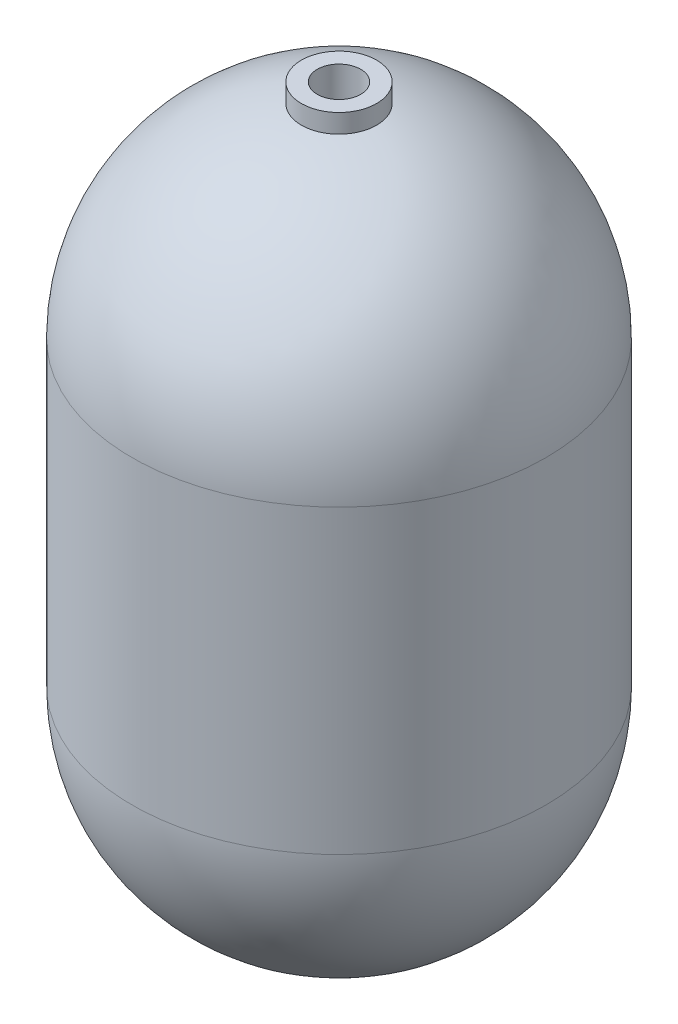
from build123d import *

# Parameters (mm, degrees)
F_5_8_18_TAPPED_HOLE2_D     = 14.68374
F_5_8_18_TAPPED_HOLE2_DEPTH = 38.862
F_5_8_18_TAPPED_HOLE2_TIP   = 4.411440553


with BuildPart() as part:
    # Sketch4 → Revolve1 (revolve)
    with BuildSketch(Plane.XY, mode=Mode.PRIVATE) as revolve1_sk:
        with BuildLine():
            Line((12.7, 75.035751798), (12.7, 68.685751798))
            ThreePointArc((12.7, 68.685751798), (53.694122118, 44.676210112), (69.85, 0))
            Line((69.85, 0), (69.85, -101.6))
            ThreePointArc((69.85, -101.6), (49.391408666, -150.991408666), (0, -171.45))
            Line((0, -171.45), (0, -165.1))
            ThreePointArc((0, -165.1), (44.901280605, -146.501280605), (63.5, -101.6))
            Line((63.5, -101.6), (63.5, 0))
            ThreePointArc((63.5, 0), (47.092860393, 42.597094971), (6.35, 63.181702256))
            ThreePointArc((6.35, 63.181702256), (4.447011473, 63.344092771), (2.54, 63.449179664))
            Line((2.54, 63.449179664), (2.54, 75.035751798))
            Line((2.54, 75.035751798), (6.35, 75.035751798))
            Line((6.35, 75.035751798), (12.7, 75.035751798))
        make_face()
    revolve(revolve1_sk.sketch.rotate(Axis((0, 80.447885323, 0), (0, -1, 0)), 180), axis=Axis((0, 80.447885323, 0), (0, -1, 0)))

    # 5/8-18 Tapped Hole2
    with Locations(Plane(origin=(0, 75.035751798, 0), x_dir=(1, 0, 0), z_dir=(0, 1, 0))):
        with Locations((0, 0)):
            Hole(F_5_8_18_TAPPED_HOLE2_D / 2, depth=F_5_8_18_TAPPED_HOLE2_DEPTH)
            with Locations((0, 0, -(F_5_8_18_TAPPED_HOLE2_DEPTH + F_5_8_18_TAPPED_HOLE2_TIP / 2))):  # 118° drill point
                Cone(0, F_5_8_18_TAPPED_HOLE2_D / 2, F_5_8_18_TAPPED_HOLE2_TIP, mode=Mode.SUBTRACT)


solid = part.part
